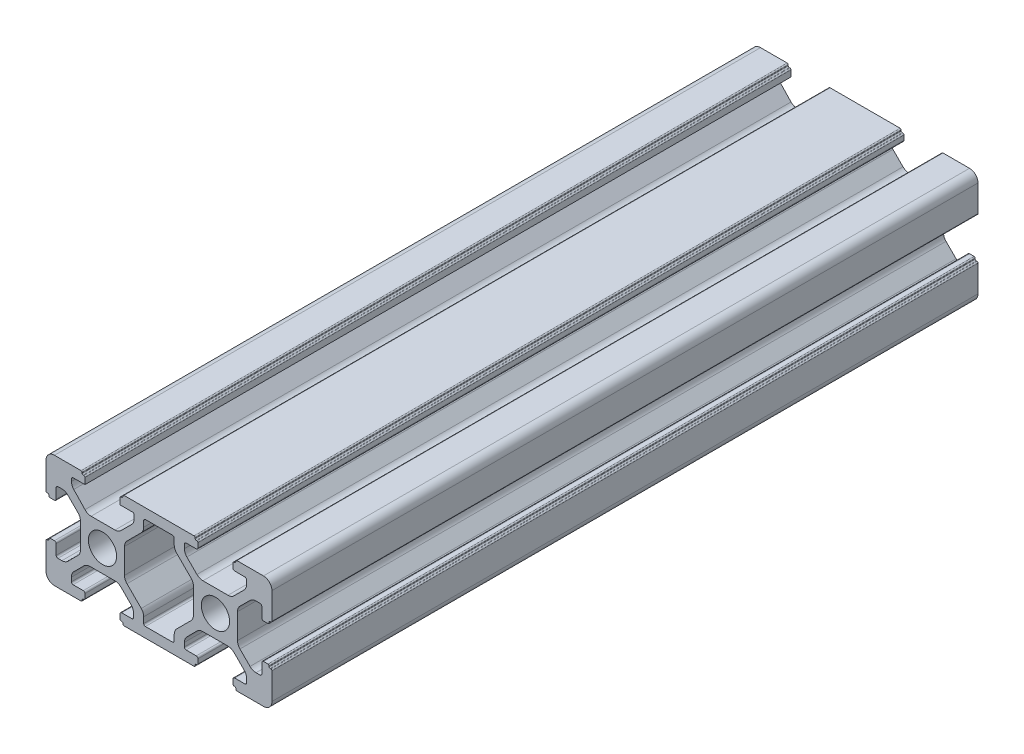
from build123d import *

# Parameters (mm, degrees)
SKETCH1_R           = 2.5
BOSS_EXTRUDE2_DEPTH = 125


with BuildPart() as part:
    # Sketch1 → Boss-Extrude2 (new body)
    with BuildSketch(Plane.XY):
        with BuildLine():
            Line((1.5, 0), (6.2, 0))
            ThreePointArc((6.2, 0), (6.341421356, 0.058578644), (6.4, 0.2))
            Line((6.4, 0.2), (6.4, 0.3))
            ThreePointArc((6.4, 0.3), (6.458578644, 0.441421356), (6.6, 0.5))
            Line((6.6, 0.5), (6.7, 0.5))
            ThreePointArc((6.7, 0.5), (6.841421356, 0.558578644), (6.9, 0.7))
            Line((6.9, 0.7), (6.9, 1.5))
            ThreePointArc((6.9, 1.5), (6.812132034, 1.712132034), (6.6, 1.8))
            Line((6.6, 1.8), (4.8, 1.8))
            ThreePointArc((4.8, 1.8), (4.587867966, 1.887867966), (4.5, 2.1))
            Line((4.5, 2.1), (4.5, 2.818019485))
            ThreePointArc((4.5, 2.818019485), (4.614180701, 3.392044633), (4.939339828, 3.878679656))
            Line((4.939339828, 3.878679656), (6.721320344, 5.660660172))
            ThreePointArc((6.721320344, 5.660660172), (7.207955367, 5.985819299), (7.781980515, 6.1))
            Line((7.781980515, 6.1), (12.218019485, 6.1))
            ThreePointArc((12.218019485, 6.1), (12.792044633, 5.985819299), (13.278679656, 5.660660172))
            Line((13.278679656, 5.660660172), (15.060660172, 3.878679656))
            ThreePointArc((15.060660172, 3.878679656), (15.385819299, 3.392044633), (15.5, 2.818019485))
            Line((15.5, 2.818019485), (15.5, 2.1))
            ThreePointArc((15.5, 2.1), (15.412132034, 1.887867966), (15.2, 1.8))
            Line((15.2, 1.8), (13.4, 1.8))
            ThreePointArc((13.4, 1.8), (13.187867966, 1.712132034), (13.1, 1.5))
            Line((13.1, 1.5), (13.1, 0.7))
            ThreePointArc((13.1, 0.7), (13.158578644, 0.558578644), (13.3, 0.5))
            Line((13.3, 0.5), (13.4, 0.5))
            ThreePointArc((13.4, 0.5), (13.541421356, 0.441421356), (13.6, 0.3))
            Line((13.6, 0.3), (13.6, 0.2))
            ThreePointArc((13.6, 0.2), (13.658578644, 0.058578644), (13.8, 0))
            Line((13.8, 0), (26.2, 0))
            ThreePointArc((26.2, 0), (26.341421356, 0.058578644), (26.4, 0.2))
            Line((26.4, 0.2), (26.4, 0.3))
            ThreePointArc((26.4, 0.3), (26.458578644, 0.441421356), (26.6, 0.5))
            Line((26.6, 0.5), (26.7, 0.5))
            ThreePointArc((26.7, 0.5), (26.841421356, 0.558578644), (26.9, 0.7))
            Line((26.9, 0.7), (26.9, 1.5))
            ThreePointArc((26.9, 1.5), (26.812132034, 1.712132034), (26.6, 1.8))
            Line((26.6, 1.8), (24.8, 1.8))
            ThreePointArc((24.8, 1.8), (24.587867966, 1.887867966), (24.5, 2.1))
            Line((24.5, 2.1), (24.5, 2.818019485))
            ThreePointArc((24.5, 2.818019485), (24.614180701, 3.392044633), (24.939339828, 3.878679656))
            Line((24.939339828, 3.878679656), (26.721320344, 5.660660172))
            ThreePointArc((26.721320344, 5.660660172), (27.207955367, 5.985819299), (27.781980515, 6.1))
            Line((27.781980515, 6.1), (32.218019485, 6.1))
            ThreePointArc((32.218019485, 6.1), (32.792044633, 5.985819299), (33.278679656, 5.660660172))
            Line((33.278679656, 5.660660172), (35.060660172, 3.878679656))
            ThreePointArc((35.060660172, 3.878679656), (35.385819299, 3.392044633), (35.5, 2.818019485))
            Line((35.5, 2.818019485), (35.5, 2.1))
            ThreePointArc((35.5, 2.1), (35.412132034, 1.887867966), (35.2, 1.8))
            Line((35.2, 1.8), (33.4, 1.8))
            ThreePointArc((33.4, 1.8), (33.187867966, 1.712132034), (33.1, 1.5))
            Line((33.1, 1.5), (33.1, 0.7))
            ThreePointArc((33.1, 0.7), (33.158578644, 0.558578644), (33.3, 0.5))
            Line((33.3, 0.5), (33.4, 0.5))
            ThreePointArc((33.4, 0.5), (33.541421356, 0.441421356), (33.6, 0.3))
            Line((33.6, 0.3), (33.6, 0.2))
            ThreePointArc((33.6, 0.2), (33.658578644, 0.058578644), (33.8, 0))
            Line((33.8, 0), (38.5, 0))
            ThreePointArc((38.5, 0), (39.560660172, 0.439339828), (40, 1.5))
            Line((40, 1.5), (40, 6.2))
            ThreePointArc((40, 6.2), (39.941421356, 6.341421356), (39.8, 6.4))
            Line((39.8, 6.4), (39.7, 6.4))
            ThreePointArc((39.7, 6.4), (39.558578644, 6.458578644), (39.5, 6.6))
            Line((39.5, 6.6), (39.5, 6.7))
            ThreePointArc((39.5, 6.7), (39.441421356, 6.841421356), (39.3, 6.9))
            Line((39.3, 6.9), (38.5, 6.9))
            ThreePointArc((38.5, 6.9), (38.287867966, 6.812132034), (38.2, 6.6))
            Line((38.2, 6.6), (38.2, 4.8))
            ThreePointArc((38.2, 4.8), (38.112132034, 4.587867966), (37.9, 4.5))
            Line((37.9, 4.5), (37.181980515, 4.5))
            ThreePointArc((37.181980515, 4.5), (36.607955367, 4.614180701), (36.121320344, 4.939339828))
            Line((36.121320344, 4.939339828), (34.339339828, 6.721320344))
            ThreePointArc((34.339339828, 6.721320344), (34.014180701, 7.207955367), (33.9, 7.781980515))
            Line((33.9, 7.781980515), (33.9, 12.218019485))
            ThreePointArc((33.9, 12.218019485), (34.014180701, 12.792044633), (34.339339828, 13.278679656))
            Line((34.339339828, 13.278679656), (36.121320344, 15.060660172))
            ThreePointArc((36.121320344, 15.060660172), (36.607955367, 15.385819299), (37.181980515, 15.5))
            Line((37.181980515, 15.5), (37.9, 15.5))
            ThreePointArc((37.9, 15.5), (38.112132034, 15.412132034), (38.2, 15.2))
            Line((38.2, 15.2), (38.2, 13.4))
            ThreePointArc((38.2, 13.4), (38.287867966, 13.187867966), (38.5, 13.1))
            Line((38.5, 13.1), (39.3, 13.1))
            ThreePointArc((39.3, 13.1), (39.441421356, 13.158578644), (39.5, 13.3))
            Line((39.5, 13.3), (39.5, 13.4))
            ThreePointArc((39.5, 13.4), (39.558578644, 13.541421356), (39.7, 13.6))
            Line((39.7, 13.6), (39.8, 13.6))
            ThreePointArc((39.8, 13.6), (39.941421356, 13.658578644), (40, 13.8))
            Line((40, 13.8), (40, 18.5))
            ThreePointArc((40, 18.5), (39.560660172, 19.560660172), (38.5, 20))
            Line((38.5, 20), (33.8, 20))
            ThreePointArc((33.8, 20), (33.658578644, 19.941421356), (33.6, 19.8))
            Line((33.6, 19.8), (33.6, 19.7))
            ThreePointArc((33.6, 19.7), (33.541421356, 19.558578644), (33.4, 19.5))
            Line((33.4, 19.5), (33.3, 19.5))
            ThreePointArc((33.3, 19.5), (33.158578644, 19.441421356), (33.1, 19.3))
            Line((33.1, 19.3), (33.1, 18.5))
            ThreePointArc((33.1, 18.5), (33.187867966, 18.287867966), (33.4, 18.2))
            Line((33.4, 18.2), (35.2, 18.2))
            ThreePointArc((35.2, 18.2), (35.412132034, 18.112132034), (35.5, 17.9))
            Line((35.5, 17.9), (35.5, 17.181980515))
            ThreePointArc((35.5, 17.181980515), (35.385819299, 16.607955367), (35.060660172, 16.121320344))
            Line((35.060660172, 16.121320344), (33.278679656, 14.339339828))
            ThreePointArc((33.278679656, 14.339339828), (32.792044633, 14.014180701), (32.218019485, 13.9))
            Line((32.218019485, 13.9), (27.781980515, 13.9))
            ThreePointArc((27.781980515, 13.9), (27.207955367, 14.014180701), (26.721320344, 14.339339828))
            Line((26.721320344, 14.339339828), (24.939339828, 16.121320344))
            ThreePointArc((24.939339828, 16.121320344), (24.614180701, 16.607955367), (24.5, 17.181980515))
            Line((24.5, 17.181980515), (24.5, 17.9))
            ThreePointArc((24.5, 17.9), (24.587867966, 18.112132034), (24.8, 18.2))
            Line((24.8, 18.2), (26.6, 18.2))
            ThreePointArc((26.6, 18.2), (26.812132034, 18.287867966), (26.9, 18.5))
            Line((26.9, 18.5), (26.9, 19.3))
            ThreePointArc((26.9, 19.3), (26.841421356, 19.441421356), (26.7, 19.5))
            Line((26.7, 19.5), (26.6, 19.5))
            ThreePointArc((26.6, 19.5), (26.458578644, 19.558578644), (26.4, 19.7))
            Line((26.4, 19.7), (26.4, 19.8))
            ThreePointArc((26.4, 19.8), (26.341421356, 19.941421356), (26.2, 20))
            Line((26.2, 20), (13.8, 20))
            ThreePointArc((13.8, 20), (13.658578644, 19.941421356), (13.6, 19.8))
            Line((13.6, 19.8), (13.6, 19.7))
            ThreePointArc((13.6, 19.7), (13.541421356, 19.558578644), (13.4, 19.5))
            Line((13.4, 19.5), (13.3, 19.5))
            ThreePointArc((13.3, 19.5), (13.158578644, 19.441421356), (13.1, 19.3))
            Line((13.1, 19.3), (13.1, 18.2))
            Line((13.1, 18.2), (15.3, 18.2))
            ThreePointArc((15.3, 18.2), (15.512132034, 18.112132034), (15.6, 17.9))
            Line((15.6, 17.9), (15.6, 17.281980515))
            ThreePointArc((15.6, 17.281980515), (15.485819299, 16.707955367), (15.160660172, 16.221320344))
            Line((15.160660172, 16.221320344), (13.278679656, 14.339339828))
            ThreePointArc((13.278679656, 14.339339828), (12.792044633, 14.014180701), (12.218019485, 13.9))
            Line((12.218019485, 13.9), (7.986375635, 13.9))
            ThreePointArc((7.986375635, 13.9), (7.393381044, 14.022191082), (6.896997987, 14.36885678))
            Line((6.896997987, 14.36885678), (4.910622352, 16.467414163))
            ThreePointArc((4.910622352, 16.467414163), (4.606431474, 16.943609851), (4.5, 17.498557383))
            Line((4.5, 17.498557383), (4.5, 17.9))
            ThreePointArc((4.5, 17.9), (4.587867966, 18.112132034), (4.8, 18.2))
            Line((4.8, 18.2), (6.9, 18.2))
            Line((6.9, 18.2), (6.9, 19.3))
            ThreePointArc((6.9, 19.3), (6.841421356, 19.441421356), (6.7, 19.5))
            Line((6.7, 19.5), (6.6, 19.5))
            ThreePointArc((6.6, 19.5), (6.458578644, 19.558578644), (6.4, 19.7))
            Line((6.4, 19.7), (6.4, 19.8))
            ThreePointArc((6.4, 19.8), (6.341421356, 19.941421356), (6.2, 20))
            Line((6.2, 20), (1.5, 20))
            ThreePointArc((1.5, 20), (0.439339828, 19.560660172), (0, 18.5))
            Line((0, 18.5), (0, 13.8))
            ThreePointArc((0, 13.8), (0.058578644, 13.658578644), (0.2, 13.6))
            Line((0.2, 13.6), (0.3, 13.6))
            ThreePointArc((0.3, 13.6), (0.441421356, 13.541421356), (0.5, 13.4))
            Line((0.5, 13.4), (0.5, 13.3))
            ThreePointArc((0.5, 13.3), (0.558578644, 13.158578644), (0.7, 13.1))
            Line((0.7, 13.1), (1.5, 13.1))
            ThreePointArc((1.5, 13.1), (1.712132034, 13.187867966), (1.8, 13.4))
            Line((1.8, 13.4), (1.8, 15.2))
            ThreePointArc((1.8, 15.2), (1.887867966, 15.412132034), (2.1, 15.5))
            Line((2.1, 15.5), (2.818019485, 15.5))
            ThreePointArc((2.818019485, 15.5), (3.392044633, 15.385819299), (3.878679656, 15.060660172))
            Line((3.878679656, 15.060660172), (5.660660172, 13.278679656))
            ThreePointArc((5.660660172, 13.278679656), (5.985819299, 12.792044633), (6.1, 12.218019485))
            Line((6.1, 12.218019485), (6.1, 7.781980515))
            ThreePointArc((6.1, 7.781980515), (5.985819299, 7.207955367), (5.660660172, 6.721320344))
            Line((5.660660172, 6.721320344), (3.878679656, 4.939339828))
            ThreePointArc((3.878679656, 4.939339828), (3.392044633, 4.614180701), (2.818019485, 4.5))
            Line((2.818019485, 4.5), (2.1, 4.5))
            ThreePointArc((2.1, 4.5), (1.887867966, 4.587867966), (1.8, 4.8))
            Line((1.8, 4.8), (1.8, 6.6))
            ThreePointArc((1.8, 6.6), (1.712132034, 6.812132034), (1.5, 6.9))
            Line((1.5, 6.9), (0.7, 6.9))
            ThreePointArc((0.7, 6.9), (0.558578644, 6.841421356), (0.5, 6.7))
            Line((0.5, 6.7), (0.5, 6.6))
            ThreePointArc((0.5, 6.6), (0.441421356, 6.458578644), (0.3, 6.4))
            Line((0.3, 6.4), (0.2, 6.4))
            ThreePointArc((0.2, 6.4), (0.058578644, 6.341421356), (0, 6.2))
            Line((0, 6.2), (0, 1.5))
            ThreePointArc((0, 1.5), (0.439339828, 0.439339828), (1.5, 0))
        make_face()
        with Locations((10, 10)):
            Circle(SKETCH1_R, mode=Mode.SUBTRACT)
        with Locations((30, 10)):
            Circle(SKETCH1_R, mode=Mode.SUBTRACT)
        with BuildLine():
            Line((17.6, 1.8), (22.4, 1.8))
            ThreePointArc((22.4, 1.8), (22.612132034, 1.887867966), (22.7, 2.1))
            Line((22.7, 2.1), (22.7, 3.139339828))
            ThreePointArc((22.7, 3.139339828), (22.814180701, 3.713364977), (23.139339828, 4.2))
            Line((23.139339828, 4.2), (25.660660172, 6.721320344))
            ThreePointArc((25.660660172, 6.721320344), (25.985819299, 7.207955367), (26.1, 7.781980515))
            Line((26.1, 7.781980515), (26.1, 12.218019485))
            ThreePointArc((26.1, 12.218019485), (25.985819299, 12.792044633), (25.660660172, 13.278679656))
            Line((25.660660172, 13.278679656), (23.139339828, 15.8))
            ThreePointArc((23.139339828, 15.8), (22.814180701, 16.286635023), (22.7, 16.860660172))
            Line((22.7, 16.860660172), (22.7, 17.9))
            ThreePointArc((22.7, 17.9), (22.612132034, 18.112132034), (22.4, 18.2))
            Line((22.4, 18.2), (17.6, 18.2))
            ThreePointArc((17.6, 18.2), (17.387867966, 18.112132034), (17.3, 17.9))
            Line((17.3, 17.9), (17.3, 16.860660172))
            ThreePointArc((17.3, 16.860660172), (17.185819299, 16.286635023), (16.860660172, 15.8))
            Line((16.860660172, 15.8), (14.339339828, 13.278679656))
            ThreePointArc((14.339339828, 13.278679656), (14.014180701, 12.792044633), (13.9, 12.218019485))
            Line((13.9, 12.218019485), (13.9, 7.781980515))
            ThreePointArc((13.9, 7.781980515), (14.014180701, 7.207955367), (14.339339828, 6.721320344))
            Line((14.339339828, 6.721320344), (16.860660172, 4.2))
            ThreePointArc((16.860660172, 4.2), (17.185819299, 3.713364977), (17.3, 3.139339828))
            Line((17.3, 3.139339828), (17.3, 2.1))
            ThreePointArc((17.3, 2.1), (17.387867966, 1.887867966), (17.6, 1.8))
        make_face(mode=Mode.SUBTRACT)
    extrude(amount=BOSS_EXTRUDE2_DEPTH)


solid = part.part
